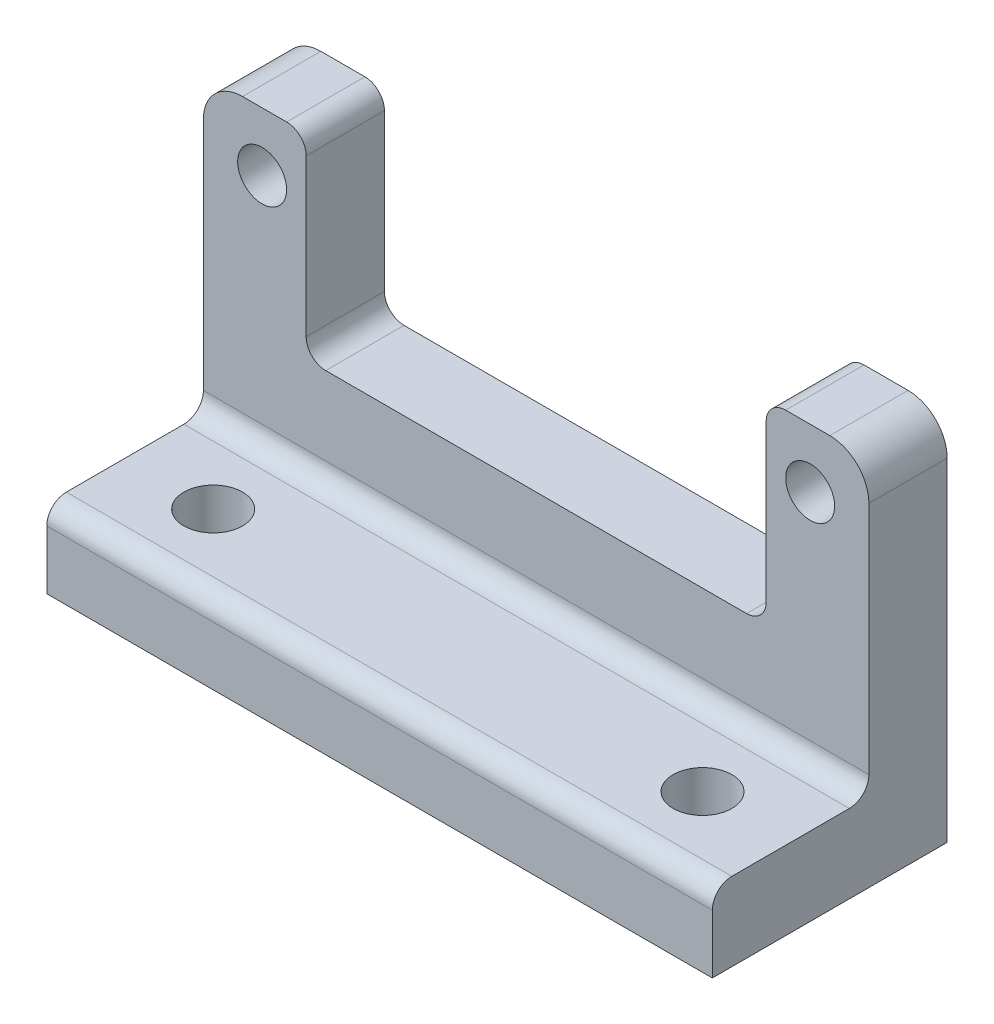
from build123d import *

# Parameters (mm, degrees)
SKETCH_1_W          = 34
SKETCH_1_H          = 12
SKETCH_1_R          = 1.5
EXTRUDE_4_DEPTH     = 4
SKETCH_4_W          = 34
SKETCH_4_H          = 4
EXTRUDE_5_DEPTH     = 15
SKETCH_5_R          = 1.25
SKETCH_5_W          = 23.5
SKETCH_5_H          = 10
CUT_EXTRUDE_1_DEPTH = 40.761790704
FILLET_4_R          = 1
FILLET_6_R          = 2
FILLET_7_R          = 2
FILLET_8_R          = 1
FILLET_9_R          = 1
FILLET_10_R         = 1
FILLET_11_R         = 1


with BuildPart() as part:
    # 草图1 → 凸台-拉伸4 (new body)
    with BuildSketch(Plane(origin=(0, 0, 0), x_dir=(1, 0, 0), z_dir=(0, 1, 0))):
        with Locations((17, -6)):
            Rectangle(SKETCH_1_W, SKETCH_1_H)
        with Locations(Location((4.5, -8, 0), (0, 0, 270))):
            Circle(SKETCH_1_R, mode=Mode.SUBTRACT)
        with Locations(Location((29.5, -8, 0), (0, 0, 270))):
            Circle(SKETCH_1_R, mode=Mode.SUBTRACT)
    extrude(amount=EXTRUDE_4_DEPTH)

    # 草图4 → 凸台-拉伸5 (add)
    with BuildSketch(Plane(origin=(0, 4, 0), x_dir=(1, 0, 0), z_dir=(0, 1, 0))):
        with Locations((17, -2)):
            Rectangle(SKETCH_4_W, SKETCH_4_H)
    extrude(amount=EXTRUDE_5_DEPTH)

    # 草图5 → 切除-拉伸1 (cut, through all)
    with BuildSketch(Plane.XY.offset(4)):
        with Locations((3, 16)):
            Circle(SKETCH_5_R)
        with Locations((31, 16)):
            Circle(SKETCH_5_R)
        with Locations((17, 14)):
            Rectangle(SKETCH_5_W, SKETCH_5_H)
    extrude(amount=-CUT_EXTRUDE_1_DEPTH, mode=Mode.SUBTRACT)

    # 圆角4
    fillet_4_edges = [part.edges().sort_by_distance(p)[0] for p in [
        (17, 4, 12),
    ]]
    fillet(fillet_4_edges, radius=FILLET_4_R)

    # 圆角6
    fillet_6_edges = [part.edges().sort_by_distance(p)[0] for p in [
        (0, 19, 2),
    ]]
    fillet(fillet_6_edges, radius=FILLET_6_R)

    # 圆角7
    fillet_7_edges = [part.edges().sort_by_distance(p)[0] for p in [
        (34, 19, 2),
    ]]
    fillet(fillet_7_edges, radius=FILLET_7_R)

    # 圆角8
    fillet_8_edges = [part.edges().sort_by_distance(p)[0] for p in [
        (5.25, 9, 2),
    ]]
    fillet(fillet_8_edges, radius=FILLET_8_R)

    # 圆角9
    fillet_9_edges = [part.edges().sort_by_distance(p)[0] for p in [
        (28.75, 9, 2),
    ]]
    fillet(fillet_9_edges, radius=FILLET_9_R)

    # 圆角10
    fillet_10_edges = [part.edges().sort_by_distance(p)[0] for p in [
        (5.25, 19, 2),
        (28.75, 19, 2),
    ]]
    fillet(fillet_10_edges, radius=FILLET_10_R)

    # 圆角11
    fillet_11_edges = [part.edges().sort_by_distance(p)[0] for p in [
        (17, 4, 4),
    ]]
    fillet(fillet_11_edges, radius=FILLET_11_R)


solid = part.part
